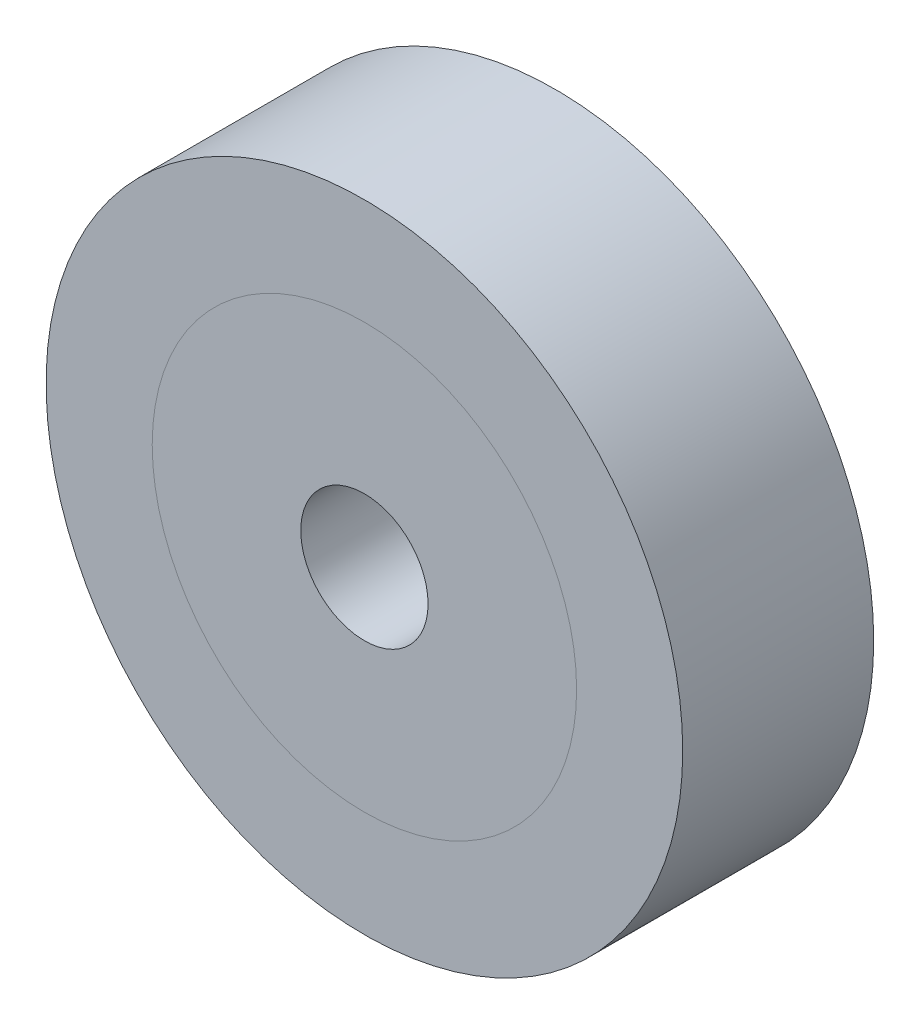
from build123d import *

# Parameters (mm, degrees)
SKETCH_1_R      = 15
SKETCH_1_R_2    = 3
EXTRUDE_1_DEPTH = 4.5


with BuildPart() as part:
    # 草图1 → 凸台-拉伸1 (new, symmetric)
    with BuildSketch(Plane.XY):
        Circle(SKETCH_1_R)
        Circle(SKETCH_1_R_2, mode=Mode.SUBTRACT)
    extrude(amount=EXTRUDE_1_DEPTH, both=True)


solid = part.part
